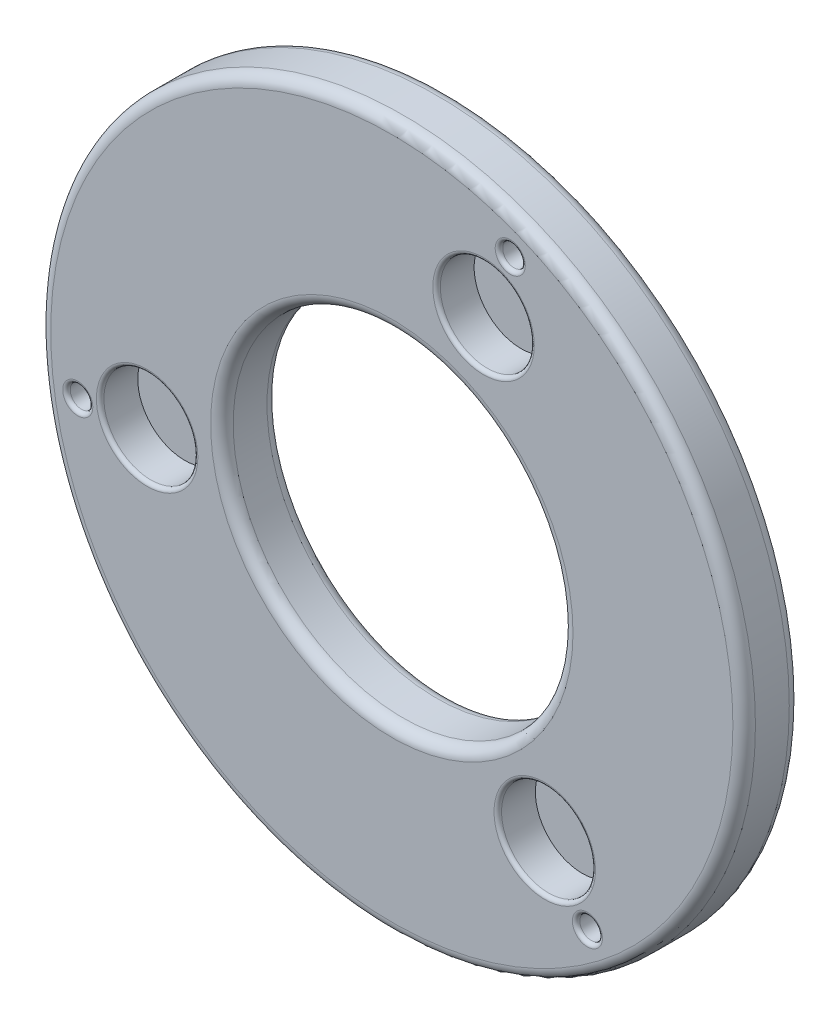
from build123d import *

# Parameters (mm, degrees)
SKETCH1_R           = 187.5
BOSS_EXTRUDE1_DEPTH = 30
SKETCH3_R           = 25
CUT_EXTRUDE1_DEPTH  = 20
CUT_EXTRUDE2_DEPTH  = 30
FILLET1_R           = 2
FILLET2_R           = 2
FILLET3_R           = 6
SKETCH4_R           = 90.422365659
CUT_EXTRUDE3_DEPTH  = 30
FILLET4_R           = 6


with BuildPart() as part:
    # Sketch1 → Boss-Extrude1 (new body)
    with BuildSketch(Plane.XY):
        Circle(SKETCH1_R)
    extrude(amount=BOSS_EXTRUDE1_DEPTH)

    # Sketch3 → Cut-Extrude1 (cut)
    with BuildSketch(Plane.XY.offset(30)):
        with Locations((48.810456462, 122.158080297)):
            Circle(SKETCH3_R)
        with Locations((81.386772583, -103.350135415)):
            Circle(SKETCH3_R)
        with Locations((-130.197229045, -18.807944882)):
            Circle(SKETCH3_R)
    extrude(amount=-CUT_EXTRUDE1_DEPTH, mode=Mode.SUBTRACT)

    # Sketch3<3> → Cut-Extrude2 (cut)
    with BuildSketch(Plane.XY.offset(30)):
        with BuildLine():
            ThreePointArc((-161.101664184, -23.703668755), (-161.429809281, -21.746614345), (-162.378351505, -20.003625871))
            Line((-162.378351505, -20.003625871), (-167.101664184, -23.703668755))
            Line((-167.101664184, -23.703668755), (-161.535676712, -25.944156082))
            ThreePointArc((-161.535676712, -25.944156082), (-161.211166546, -24.84473737), (-161.101664184, -23.703668755))
        make_face()
        with BuildLine():
            Line((-167.101664184, -23.703668755), (-162.378351505, -20.003625871))
            ThreePointArc((-162.378351505, -20.003625871), (-173.042194395, -24.546343549), (-161.535676712, -25.944156082))
            Line((-161.535676712, -25.944156082), (-167.101664184, -23.703668755))
        make_face()
        with BuildLine():
            ThreePointArc((110.078811397, -132.86245182), (108.012254623, -128.331665533), (103.236136603, -126.921921609))
            Line((103.236136603, -126.921921609), (104.078811397, -132.86245182))
            Line((104.078811397, -132.86245182), (98.512823925, -130.621964493))
            ThreePointArc((98.512823925, -130.621964493), (102.937742781, -138.752949457), (110.078811397, -132.86245182))
        make_face()
        with BuildLine():
            Line((104.078811397, -132.86245182), (103.236136603, -126.921921609))
            ThreePointArc((103.236136603, -126.921921609), (100.378768513, -128.139139142), (98.512823925, -130.621964493))
            Line((98.512823925, -130.621964493), (104.078811397, -132.86245182))
        make_face()
        with BuildLine():
            ThreePointArc((69.022852787, 156.566120575), (61.065798377, 162.237975478), (58.299540109, 152.866077691))
            Line((58.299540109, 152.866077691), (63.022852787, 156.566120575))
            Line((63.022852787, 156.566120575), (63.865527581, 150.625590364))
            ThreePointArc((63.865527581, 150.625590364), (67.553639074, 152.632677348), (69.022852787, 156.566120575))
        make_face()
        with BuildLine():
            Line((63.022852787, 156.566120575), (58.299540109, 152.866077691))
            ThreePointArc((58.299540109, 152.866077691), (60.78236546, 151.000133103), (63.865527581, 150.625590364))
            Line((63.865527581, 150.625590364), (63.022852787, 156.566120575))
        make_face()
    extrude(amount=-CUT_EXTRUDE2_DEPTH, mode=Mode.SUBTRACT)

    # Fillet1
    fillet1_edges = [part.edges().sort_by_distance(p)[0] for p in [
        (23.810456462, 122.158080297, 30),
        (56.386772583, -103.350135415, 30),
        (-155.197229045, -18.807944882, 30),
    ]]
    fillet(fillet1_edges, radius=FILLET1_R)

    # Fillet2
    fillet2_edges = [part.edges().sort_by_distance(p)[0] for p in [
        (98.078811397, -132.86245182, 30),
        (98.078811397, -132.86245182, 0),
        (-172.667651655, -21.463181428, 30),
        (-172.667651655, -21.463181428, 0),
        (67.746165465, 160.266163459, 0),
        (67.746165465, 160.266163459, 30),
    ]]
    fillet(fillet2_edges, radius=FILLET2_R)

    # Fillet3
    fillet3_edges = [part.edges().sort_by_distance(p)[0] for p in [
        (-187.5, 0, 0),
        (-187.5, 0, 30),
    ]]
    fillet(fillet3_edges, radius=FILLET3_R)

    # Sketch4 → Cut-Extrude3 (cut)
    with BuildSketch(Plane.XY.offset(30)):
        Circle(SKETCH4_R)
    extrude(amount=-CUT_EXTRUDE3_DEPTH, mode=Mode.SUBTRACT)

    # Fillet4
    fillet4_edges = [part.edges().sort_by_distance(p)[0] for p in [
        (-90.422365659, 0, 30),
        (-90.422365659, 0, 0),
    ]]
    fillet(fillet4_edges, radius=FILLET4_R)


solid = part.part
